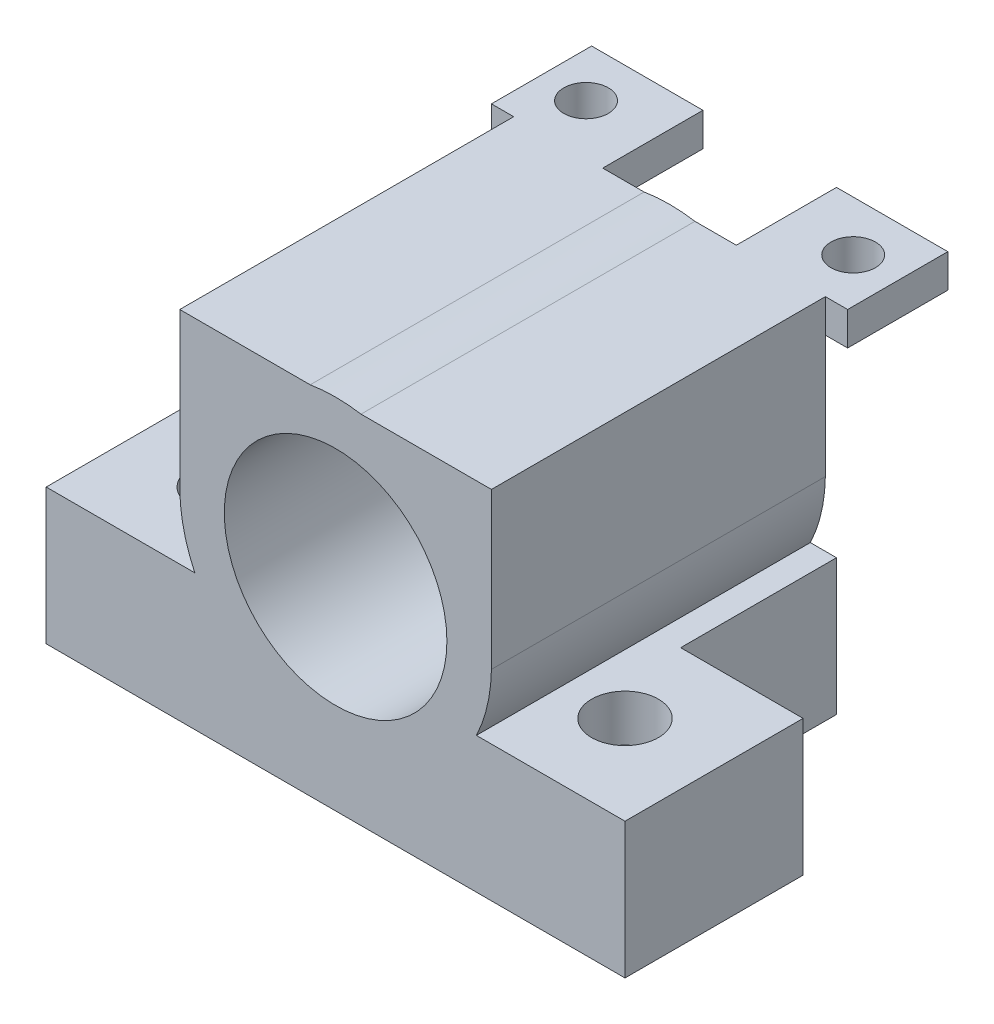
from build123d import *
from build123d.topology import SkipClean

# Parameters (mm, degrees)
RESSALTO_EXTRUS_O4_DEPTH  = 8
ESBO_O7_W                 = 26
ESBO_O7_H                 = 8
RESSALTO_EXTRUS_O5_DEPTH  = 0.1
ESBO_O8_R                 = 5
CORTE_EXTRUS_O7_DEPTH     = 17.792855624
RESSALTO_EXTRUS_O6_DEPTH  = 7
ESBO_O10_R                = 1.5
CORTE_EXTRUS_O8_DEPTH     = 19.248287591
RESSALTO_EXTRUS_O7_DEPTH  = 1.5
ESBO_O12_W                = 2.553491136
ESBO_O12_H                = 15
RESSALTO_EXTRUS_O9_DEPTH  = 5.5
ESBO_O13_R                = 5
CORTE_EXTRUS_O9_DEPTH     = 22.04756518
ESBO_O14_R                = 1.468193857
ESBO_O14_R_2              = 1.484614178
RESSALTO_EXTRUS_O10_DEPTH = 4


with BuildPart() as part:
    # Esboço4 → Ressalto-extrusão4 (new body)
    with BuildSketch(Plane.XY):
        with BuildLine():
            Line((-13, -5), (13, -5))
            Line((13, -5), (13, -3))
            Line((13, -3), (6.32455532, -3))
            ThreePointArc((6.32455532, -3), (0, 7), (-6.32455532, -3))
            Line((-6.32455532, -3), (-13, -3))
            Line((-13, -3), (-13, -5))
        make_face()
    extrude(amount=RESSALTO_EXTRUS_O4_DEPTH)

    # Esboço7 → Ressalto-extrusão5 (add)
    with BuildSketch(Plane.XZ.offset(5)):
        with Locations((0, 4)):
            Rectangle(ESBO_O7_W, ESBO_O7_H)
    extrude(amount=RESSALTO_EXTRUS_O5_DEPTH)

    # Esboço8 → Corte-extrusão7 (cut, through all)
    with BuildSketch(Plane.XY.offset(8)):
        Circle(ESBO_O8_R)
    extrude(amount=-CORTE_EXTRUS_O7_DEPTH, mode=Mode.SUBTRACT)

    # Esboço9 → Ressalto-extrusão6 (add)
    with SkipClean():  # the faces are left unmerged after this step: merging them gives an invalid solid
        with BuildSketch(Plane(origin=(0, 0, 0), x_dir=(-1, 0, 0), z_dir=(0, 0, -1))):
            with BuildLine():
                Line((-6.32455532, -3), (-7.5, -3))
                Line((-7.5, -3), (-7.5, -5.1))
                Line((-7.5, -5.1), (0, -5.1))
                Line((0, -5.1), (7.5, -5.1))
                Line((7.5, -5.1), (7.5, -3))
                Line((7.5, -3), (6.32455532, -3))
                ThreePointArc((6.32455532, -3), (0, 7), (-6.32455532, -3))
            make_face()
            with BuildLine():
                ThreePointArc((5, 0), (4.74341649, -1.58113883), (4, -3))
                ThreePointArc((4, -3), (0, -5), (-4, -3))
                ThreePointArc((-4, -3), (-1.58113883, 4.74341649), (5, 0))
            make_face(mode=Mode.SUBTRACT)
        extrude(amount=RESSALTO_EXTRUS_O6_DEPTH)

    # Esboço10 → Corte-extrusão8 (cut, through all)
    with SkipClean():  # the faces are left unmerged after this step: merging them gives an invalid solid
        with BuildSketch(Plane(origin=(0, -3, 0), x_dir=(1, 0, 0), z_dir=(0, 1, 0))):
            with Locations(Location((-9, -4, 0), (0, 0, 180))):
                Circle(ESBO_O10_R)
            with Locations(Location((9, -4, 0), (0, 0, 180))):
                Circle(ESBO_O10_R)
        extrude(amount=-CORTE_EXTRUS_O8_DEPTH, mode=Mode.SUBTRACT)

    # Esboço11 → Ressalto-extrusão7 (add)
    # profile 1 of 3: a face of its own
    with SkipClean():  # the faces are left unmerged after this step: merging them gives an invalid solid
        with BuildSketch(Plane(origin=(0, 6.906344322, 0), x_dir=(0, 0, -1), z_dir=(0, 1, 0))):
            Polygon((7, 3), (7, 7), (-8, 7), (-8, -7), (7, -7), (7, -3), align=None)
        # profile 2 of 3: a face of its own
        with BuildSketch(Plane(origin=(0, 6.906344322, 0), x_dir=(0, 0, -1), z_dir=(0, 1, 0))):
            Polygon((7, 8), (7, 7), (7, 3), (11.5, 3), (11.5, 7), (11.5, 8), (9.25, 8), align=None)
            with BuildLine():
                ThreePointArc((10.25, 6), (8.542893219, 5.292893219), (9.25, 7))
                ThreePointArc((9.25, 7), (9.957106781, 6.707106781), (10.25, 6))
            make_face(mode=Mode.SUBTRACT)
        # profile 3 of 3: a face of its own
        with BuildSketch(Plane(origin=(0, 6.906344322, 0), x_dir=(0, 0, -1), z_dir=(0, 1, 0))):
            Polygon((11.5, -3), (7, -3), (7, -7), (7, -8), (9.25, -8), (11.5, -8), (11.5, -7), align=None)
            with BuildLine():
                ThreePointArc((10.25, -6), (9.957106781, -6.707106781), (9.25, -7))
                ThreePointArc((9.25, -7), (8.542893219, -5.292893219), (10.25, -6))
            make_face(mode=Mode.SUBTRACT)
        extrude(amount=-RESSALTO_EXTRUS_O7_DEPTH)

    # Esboço12 → Ressalto-extrusão9 (add)
    with SkipClean():  # the faces are left unmerged after this step: merging them gives an invalid solid
        with BuildSketch(Plane.XZ.offset(-5.406344322)):
            with Locations((-5.723254432, 0.5)):
                Rectangle(ESBO_O12_W, ESBO_O12_H)
            with Locations((5.723254432, 0.5)):
                Rectangle(ESBO_O12_W, ESBO_O12_H)
        extrude(amount=RESSALTO_EXTRUS_O9_DEPTH)

    # Esboço13 → Corte-extrusão9 (cut, through all)
    with SkipClean():  # the faces are left unmerged after this step: merging them gives an invalid solid
        with BuildSketch(Plane(origin=(0, 0, -7), x_dir=(-1, 0, 0), z_dir=(0, 0, -1))):
            with Locations(Location((0, 0, 0), (0, 0, 180))):
                Circle(ESBO_O13_R)
        extrude(amount=-CORTE_EXTRUS_O9_DEPTH, mode=Mode.SUBTRACT)

    # Esboço14 → Ressalto-extrusão10 (add)
    with SkipClean():  # the faces are left unmerged after this step: merging them gives an invalid solid
        with BuildSketch(Plane.XZ.offset(5.1)):
            Polygon((-13, 8), (-13, 0), (-7.5, 0), (-7.5, -7), (7.5, -7), (7.5, 0), (13, 0), (13, 8), align=None)
            with Locations((-9, 4)):
                Circle(ESBO_O14_R, mode=Mode.SUBTRACT)
            with Locations((9, 4)):
                Circle(ESBO_O14_R_2, mode=Mode.SUBTRACT)
        extrude(amount=RESSALTO_EXTRUS_O10_DEPTH)


solid = part.part
